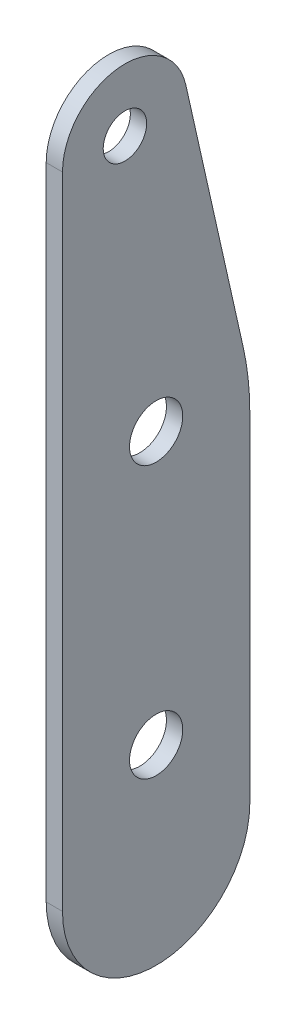
from build123d import *

# Parameters (mm, degrees)
SKETCH1_R           = 2.4892
SKETCH1_R_2         = 2.032
BOSS_EXTRUDE1_DEPTH = 1.524
FILLET1_R           = 25.4


with BuildPart() as part:
    # Sketch1 → Boss-Extrude1 (new body)
    with BuildSketch(Plane(origin=(0, 0, 0), x_dir=(0, 0, -1), z_dir=(1, 0, 0))):
        with BuildLine():
            Line((8.763, -34.506990432), (8.763, 0))
            Line((8.763, 0), (2.779382525, 26.678515962))
            ThreePointArc((2.779382525, 26.678515962), (-3.564167663, 31.206487695), (-8.763, 25.4))
            Line((-8.763, 25.4), (-8.763, -34.506990432))
            ThreePointArc((-8.763, -34.506990432), (0, -43.269990432), (8.763, -34.506990432))
        make_face()
        with Locations(Location((0, 0, 0), (0, 0, 180))):
            Circle(SKETCH1_R, mode=Mode.SUBTRACT)
        with Locations(Location((0, -25.4, 0), (0, 0, 180))):
            Circle(SKETCH1_R, mode=Mode.SUBTRACT)
        with Locations(Location((-2.921, 25.4, 0), (0, 0, 180))):
            Circle(SKETCH1_R_2, mode=Mode.SUBTRACT)
    extrude(amount=BOSS_EXTRUDE1_DEPTH)

    # Fillet1
    fillet1_edges = [part.edges().sort_by_distance(p)[0] for p in [
        (0.762, 0, -8.763),
    ]]
    fillet(fillet1_edges, radius=FILLET1_R)


solid = part.part
